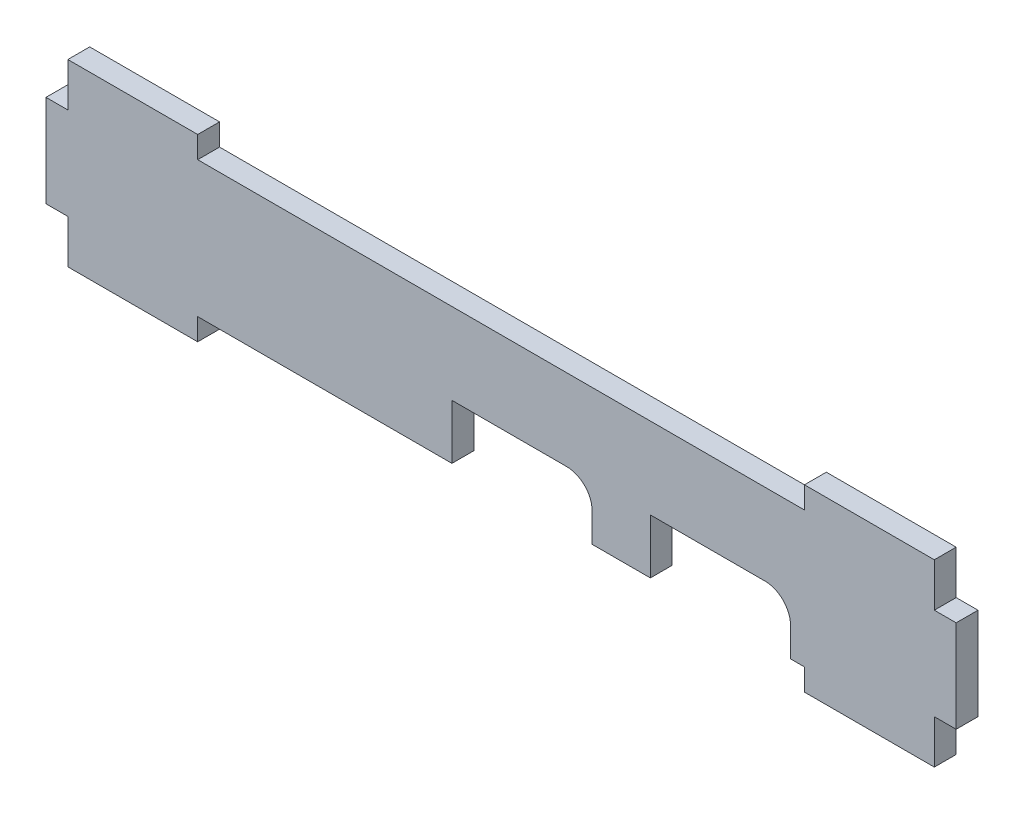
from build123d import *

# Parameters (mm, degrees)
SKETCH1_W           = 500
SKETCH1_H           = 98.65
BOSS_EXTRUDE1_DEPTH = 12
SKETCH2_W           = 12
SKETCH2_H           = 24
SKETCH2_W_2         = 333.333333334
SKETCH2_H_2         = 12
CUT_EXTRUDE1_DEPTH  = 510.78017076
SCALE1_SCALE        = 0.5
SKETCH3_W           = 38.5
SKETCH3_H           = 15
CUT_EXTRUDE2_DEPTH  = 383.276274645
FILLET1_R           = 7


with BuildPart() as part:
    # Sketch1 → Boss-Extrude1 (new body)
    with BuildSketch(Plane.XY):
        with Locations((250, 49.325)):
            Rectangle(SKETCH1_W, SKETCH1_H)
    extrude(amount=BOSS_EXTRUDE1_DEPTH)

    # Sketch2 → Cut-Extrude1 (cut, through all)
    with BuildSketch(Plane.XY.offset(12)):
        with Locations((494, 86.65)):
            Rectangle(SKETCH2_W, SKETCH2_H)
        with Locations((494, 12)):
            Rectangle(SKETCH2_W, SKETCH2_H)
        with Locations((6, 12)):
            Rectangle(SKETCH2_W, SKETCH2_H)
        with Locations((6, 86.65)):
            Rectangle(SKETCH2_W, SKETCH2_H)
        with Locations((250, 92.65)):
            Rectangle(SKETCH2_W_2, SKETCH2_H_2)
        with Locations((250, 6)):
            Rectangle(SKETCH2_W_2, SKETCH2_H_2)
    extrude(amount=-CUT_EXTRUDE1_DEPTH, mode=Mode.SUBTRACT)


with BuildPart() as part_1:
    # Scale1: scaled about (250, 49.325, 6)
    add(part.part.scale(SCALE1_SCALE).moved(Location((125, 24.6625, 3))))

    # Sketch3 → Cut-Extrude2 (cut, through all)
    with BuildSketch(Plane.XY.offset(9)):
        with Locations((310.253333333, 38.1625)):
            Rectangle(SKETCH3_W, SKETCH3_H)
        with Locations((255.753333333, 38.1625)):
            Rectangle(SKETCH3_W, SKETCH3_H)
    extrude(amount=-CUT_EXTRUDE2_DEPTH, mode=Mode.SUBTRACT)

    # Fillet1
    fillet1_edges = [part_1.edges().sort_by_distance(p)[0] for p in [
        (329.503333333, 45.6625, 6),
        (275.003333333, 45.6625, 6),
    ]]
    fillet(fillet1_edges, radius=FILLET1_R)


solid = part_1.part
